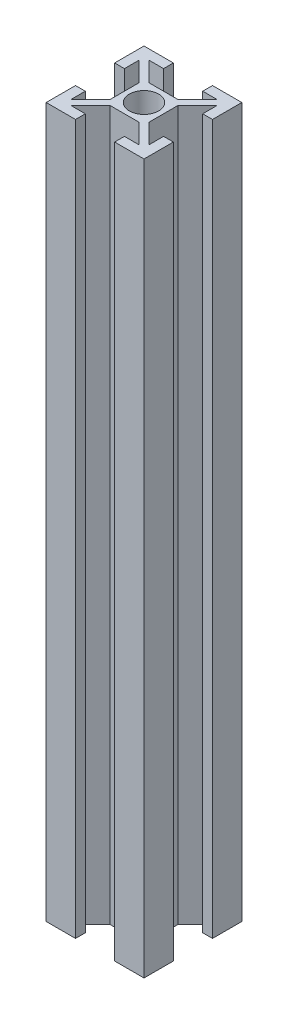
from build123d import *

# Parameters (mm, degrees)
F_2020_SKETCH_R     = 3
BOSS_EXTRUDE1_DEPTH = 145


with BuildPart() as part:
    # 2020 sketch → Boss-Extrude1 (new body)
    with BuildSketch(Plane(origin=(0, 0, 0), x_dir=(1, 0, 0), z_dir=(0, 1, 0))):
        Polygon((-4, 10), (-4, 8), (-7, 8), (-3, 4), (3, 4), (7, 8), (4, 8), (4, 10), (10, 10), (10, 4), (8, 4), (8, 7), (4, 3), (4, -3), (8, -7), (8, -4), (10, -4), (10, -10), (4, -10), (4, -8), (7, -8), (3, -4), (-3, -4), (-7, -8), (-4, -8), (-4, -10), (-10, -10), (-10, -4), (-8, -4), (-8, -7), (-4, -3), (-4, 3), (-8, 7), (-8, 4), (-10, 4), (-10, 10), align=None)
        with Locations(Location((0, 0, 0), (0, 0, 270))):
            Circle(F_2020_SKETCH_R, mode=Mode.SUBTRACT)
    extrude(amount=BOSS_EXTRUDE1_DEPTH)


solid = part.part
